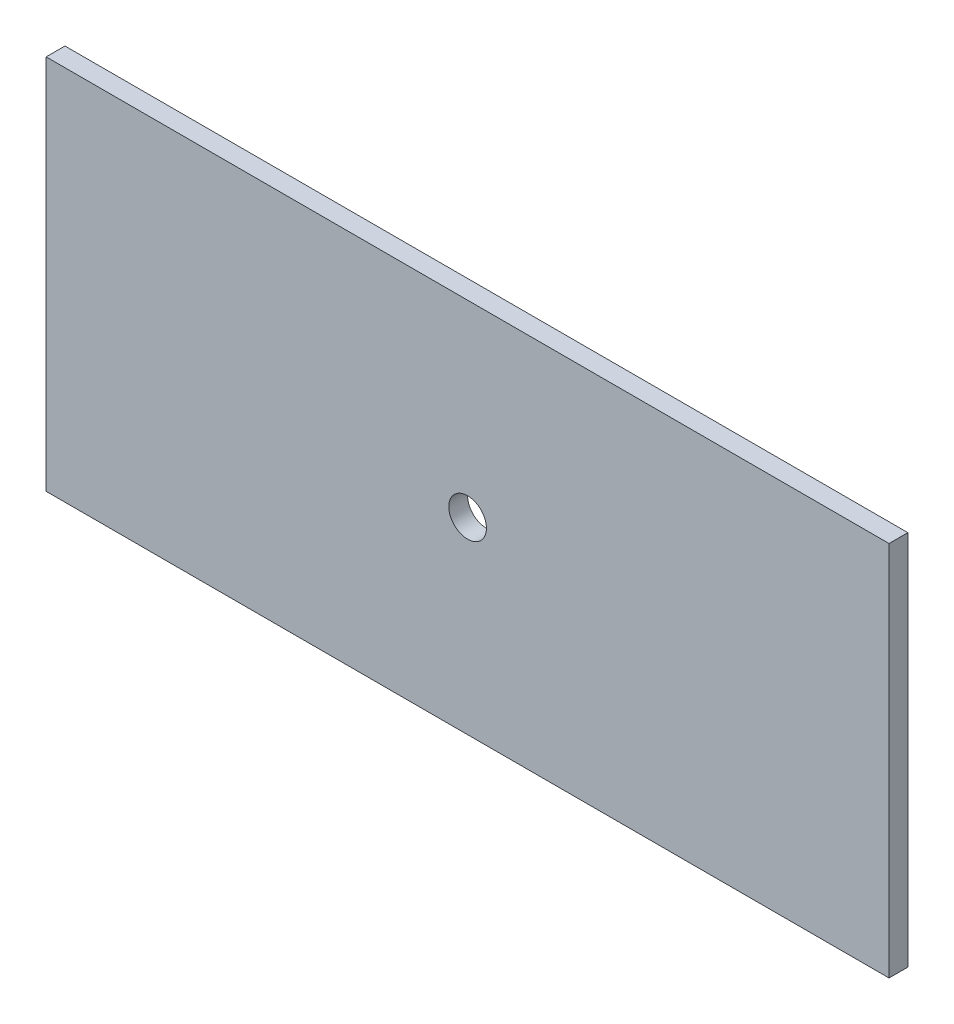
from build123d import *

# Parameters (mm, degrees)
SKETCH2_W           = 284.48
SKETCH2_H           = 127
BOSS_EXTRUDE1_DEPTH = 6.35
SKETCH3_R           = 6.35
CUT_EXTRUDE1_DEPTH  = 156.899936177


with BuildPart() as part:
    # Sketch2 → Boss-Extrude1 (new body)
    with BuildSketch(Plane.XY):
        Rectangle(SKETCH2_W, SKETCH2_H)
    extrude(amount=BOSS_EXTRUDE1_DEPTH)

    # Sketch3 → Cut-Extrude1 (cut, through all)
    with BuildSketch(Plane.XY.offset(6.35)):
        Circle(SKETCH3_R)
    extrude(amount=-CUT_EXTRUDE1_DEPTH, mode=Mode.SUBTRACT)


solid = part.part
